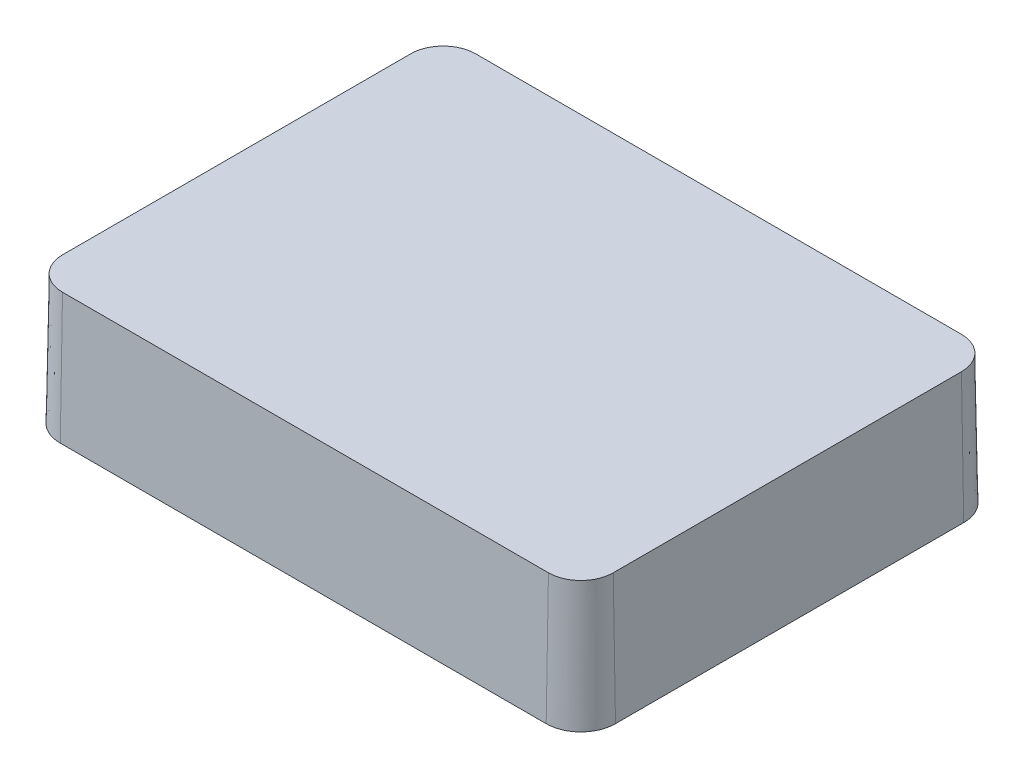
from build123d import *

# Parameters (mm, degrees)
BOSS_EXTRUDE1_DEPTH           = 4
BOSS_EXTRUDE1_DRAFT           = 1
SHELL1_T                      = -0.5
BOSS_EXTRUDE2_DEPTH           = 5.5
BOSS_EXTRUDE2_DRAFT           = 1.5
BOSS_EXTRUDE2_PROFILE_2_DEPTH = 5.5
BOSS_EXTRUDE2_PROFILE_2_DRAFT = 1.5
BOSS_EXTRUDE2_PROFILE_3_DEPTH = 5.5
BOSS_EXTRUDE2_PROFILE_3_DRAFT = 1.5
BOSS_EXTRUDE2_PROFILE_4_DEPTH = 5.5
BOSS_EXTRUDE2_PROFILE_4_DRAFT = 1.5


with BuildPart() as part:
    # Sketch1 → Boss-Extrude1 (with draft: the straight prism first)
    with BuildSketch(Plane(origin=(0, 0, 0), x_dir=(1, 0, 0), z_dir=(0, 1, 0))):
        with BuildLine():
            Line((-7.5, -6.375), (7.5, -6.375))
            ThreePointArc((7.5, -6.375), (8.207106781, -6.082106781), (8.5, -5.375))
            Line((8.5, -5.375), (8.5, 5.375))
            ThreePointArc((8.5, 5.375), (8.207106781, 6.082106781), (7.5, 6.375))
            Line((7.5, 6.375), (-7.5, 6.375))
            ThreePointArc((-7.5, 6.375), (-8.207106781, 6.082106781), (-8.5, 5.375))
            Line((-8.5, 5.375), (-8.5, -5.375))
            ThreePointArc((-8.5, -5.375), (-8.207106781, -6.082106781), (-7.5, -6.375))
        make_face()
    extrude(amount=-BOSS_EXTRUDE1_DEPTH)
    # Boss-Extrude1: the draft: its side faces are tilted about the plane it starts from
    boss_extrude1_sides = [part.faces().sort_by_distance(p)[0] for p in [
        (0, -2, 6.375),
        (8.207106781, -2, 6.082106781),
        (8.5, -2, 0),
        (8.207106781, -2, -6.082106781),
        (0, -2, -6.375),
        (-8.207106781, -2, -6.082106781),
        (-8.5, -2, 0),
        (-8.207106781, -2, 6.082106781),
    ]]
    draft(boss_extrude1_sides, Plane(origin=(0, 0, 0), x_dir=(1, 0, 0), z_dir=(0, 1, 0)), BOSS_EXTRUDE1_DRAFT)

    # Shell1
    shell1_openings = [part.faces().sort_by_distance(p)[0] for p in [
        (0, -4, 0),
    ]]
    offset(amount=SHELL1_T, openings=shell1_openings, kind=Kind.INTERSECTION)


with BuildPart() as boss_extrude2_tool:
    # Sketch2 → Boss-Extrude2 (with draft: the straight prism first)
    with BuildSketch(Plane.XZ.offset(0.5)):
        with BuildLine():
            ThreePointArc((-0.6, 2.93078798), (-2.115362638, 2.115362638), (-2.93078798, 0.6))
            Line((-2.93078798, 0.6), (-0.6, 0.6))
            Line((-0.6, 0.6), (-0.6, 2.93078798))
        make_face()
    extrude(amount=BOSS_EXTRUDE2_DEPTH)
    # Boss-Extrude2: the draft: its side faces are tilted about the plane it starts from
    boss_extrude2_sides = [boss_extrude2_tool.faces().sort_by_distance(p)[0] for p in [
        (-2.115362638, -3.25, 2.115362638),
        (-1.76539399, -3.25, 0.6),
        (-0.6, -3.25, 1.76539399),
    ]]
    draft(boss_extrude2_sides, Plane.XZ.offset(0.5), BOSS_EXTRUDE2_DRAFT)


with BuildPart() as part_1:
    add(part.part)

    # Boss-Extrude2: add boss_extrude2_tool
    add(boss_extrude2_tool.part)


with BuildPart() as boss_extrude2_profile_2_tool:
    # Sketch2 → Boss-Extrude2 profile 2 (with draft: the straight prism first)
    with BuildSketch(Plane.XZ.offset(0.5)):
        with BuildLine():
            ThreePointArc((-2.93078798, -0.6), (-2.115362638, -2.115362638), (-0.6, -2.93078798))
            Line((-0.6, -2.93078798), (-0.6, -0.6))
            Line((-0.6, -0.6), (-2.93078798, -0.6))
        make_face()
    extrude(amount=BOSS_EXTRUDE2_PROFILE_2_DEPTH)
    # Boss-Extrude2 profile 2: the draft: its side faces are tilted about the plane it starts from
    boss_extrude2_profile_2_sides = [boss_extrude2_profile_2_tool.faces().sort_by_distance(p)[0] for p in [
        (-2.115362638, -3.25, -2.115362638),
        (-0.6, -3.25, -1.76539399),
        (-1.76539399, -3.25, -0.6),
    ]]
    draft(boss_extrude2_profile_2_sides, Plane.XZ.offset(0.5), BOSS_EXTRUDE2_PROFILE_2_DRAFT)


with BuildPart() as part_2:
    add(part_1.part)

    # Boss-Extrude2 profile 2: add boss_extrude2_profile_2_tool
    add(boss_extrude2_profile_2_tool.part)


with BuildPart() as boss_extrude2_profile_3_tool:
    # Sketch2 → Boss-Extrude2 profile 3 (with draft: the straight prism first)
    with BuildSketch(Plane.XZ.offset(0.5)):
        with BuildLine():
            Line((0.6, 2.93078798), (0.6, 0.6))
            Line((0.6, 0.6), (2.93078798, 0.6))
            ThreePointArc((2.93078798, 0.6), (2.115362638, 2.115362638), (0.6, 2.93078798))
        make_face()
    extrude(amount=BOSS_EXTRUDE2_PROFILE_3_DEPTH)
    # Boss-Extrude2 profile 3: the draft: its side faces are tilted about the plane it starts from
    boss_extrude2_profile_3_sides = [boss_extrude2_profile_3_tool.faces().sort_by_distance(p)[0] for p in [
        (2.115362638, -3.25, 2.115362638),
        (0.6, -3.25, 1.76539399),
        (1.76539399, -3.25, 0.6),
    ]]
    draft(boss_extrude2_profile_3_sides, Plane.XZ.offset(0.5), BOSS_EXTRUDE2_PROFILE_3_DRAFT)


with BuildPart() as part_3:
    add(part_2.part)

    # Boss-Extrude2 profile 3: add boss_extrude2_profile_3_tool
    add(boss_extrude2_profile_3_tool.part)


with BuildPart() as boss_extrude2_profile_4_tool:
    # Sketch2 → Boss-Extrude2 profile 4 (with draft: the straight prism first)
    with BuildSketch(Plane.XZ.offset(0.5)):
        with BuildLine():
            Line((0.6, -0.6), (0.6, -2.93078798))
            ThreePointArc((0.6, -2.93078798), (2.115362638, -2.115362638), (2.93078798, -0.6))
            Line((2.93078798, -0.6), (0.6, -0.6))
        make_face()
    extrude(amount=BOSS_EXTRUDE2_PROFILE_4_DEPTH)
    # Boss-Extrude2 profile 4: the draft: its side faces are tilted about the plane it starts from
    boss_extrude2_profile_4_sides = [boss_extrude2_profile_4_tool.faces().sort_by_distance(p)[0] for p in [
        (1.76539399, -3.25, -0.6),
        (0.6, -3.25, -1.76539399),
        (2.115362638, -3.25, -2.115362638),
    ]]
    draft(boss_extrude2_profile_4_sides, Plane.XZ.offset(0.5), BOSS_EXTRUDE2_PROFILE_4_DRAFT)


with BuildPart() as part_4:
    add(part_3.part)

    # Boss-Extrude2 profile 4: add boss_extrude2_profile_4_tool
    add(boss_extrude2_profile_4_tool.part)


solid = part_4.part
